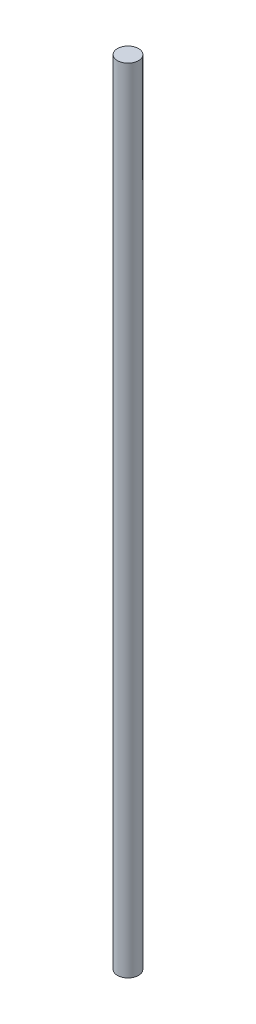
from build123d import *

# Parameters (mm, degrees)
ESBO_O1_R                = 4
RESSALTO_EXTRUS_O1_DEPTH = 151


with BuildPart() as part:
    # Esboço1 → Ressalto-extrusão1 (new, symmetric)
    with BuildSketch(Plane(origin=(0, 0, 0), x_dir=(1, 0, 0), z_dir=(0, 1, 0))):
        with Locations(Location((0, 0, 0), (0, 0, 270))):
            Circle(ESBO_O1_R)
    extrude(amount=RESSALTO_EXTRUS_O1_DEPTH, both=True)


solid = part.part
